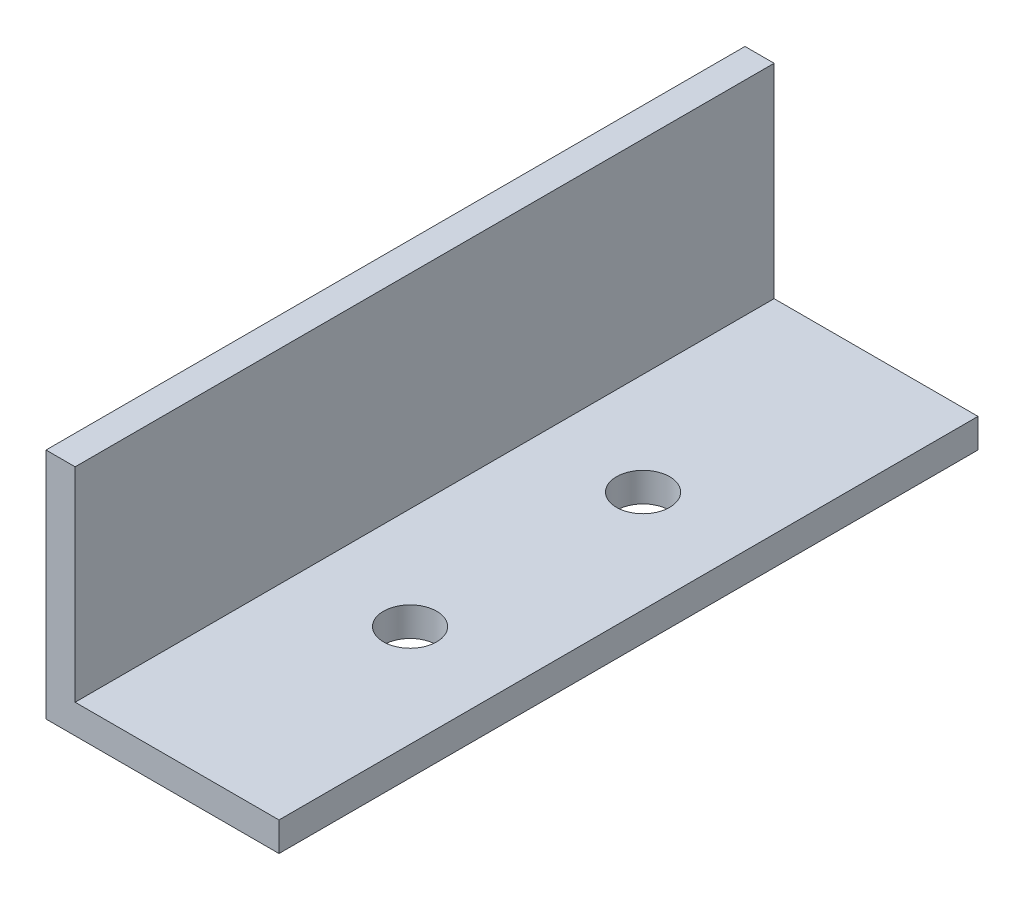
from build123d import *

# Parameters (mm, degrees)
BOSS_EXTRUDE1_DEPTH = 76.2
SKETCH2_R           = 2.9
CUT_EXTRUDE1_DEPTH  = 76.2


with BuildPart() as part:
    # Sketch1 → Boss-Extrude1 (new body)
    with BuildSketch(Plane.XY):
        Polygon((0, 0), (25.4, 0), (25.4, 3.175), (3.175, 3.175), (3.175, 25.4), (0, 25.4), align=None)
    extrude(amount=BOSS_EXTRUDE1_DEPTH)

    # Sketch2 → Cut-Extrude1 (cut)
    with BuildSketch(Plane(origin=(0, 0, 0), x_dir=(1, 0, 0), z_dir=(0, 1, 0))):
        with Locations(Location((14.2875, -25.4, 0), (0, 0, 90))):
            Circle(SKETCH2_R)
        with Locations(Location((14.2875, -50.8, 0), (0, 0, 90))):
            Circle(SKETCH2_R)
    extrude(amount=CUT_EXTRUDE1_DEPTH, mode=Mode.SUBTRACT)


solid = part.part
